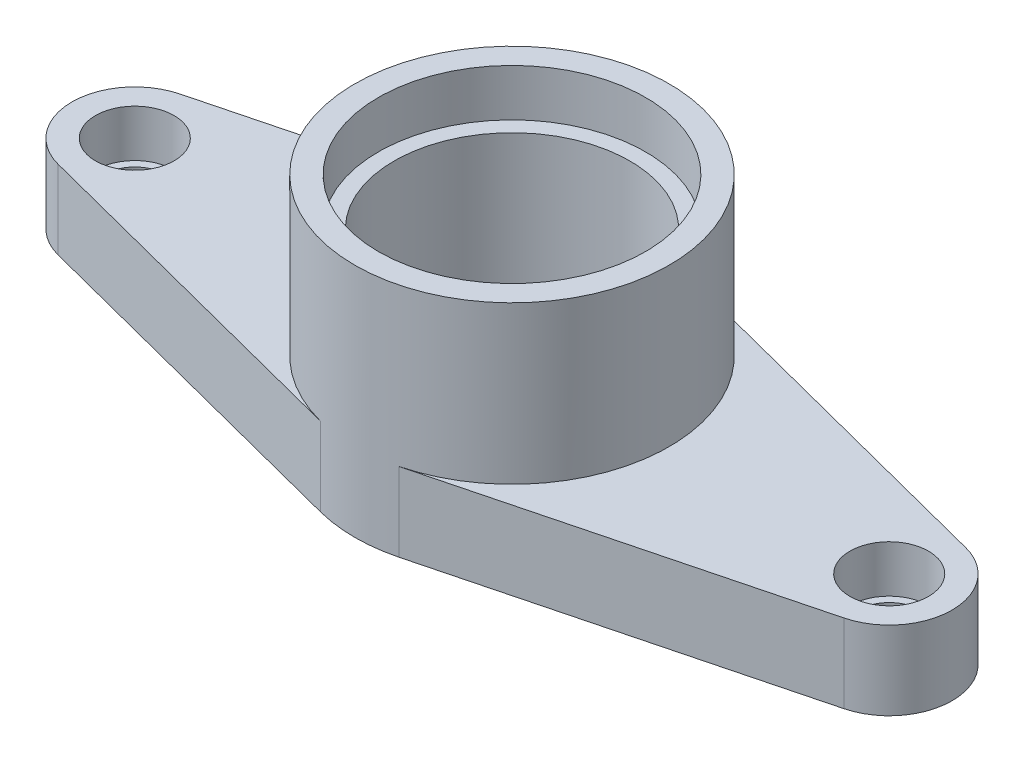
from build123d import *

# Parameters (mm, degrees)
SALIENTE_EXTRUIR1_DEPTH = 25
CROQUIS2_R              = 50
SALIENTE_EXTRUIR2_DEPTH = 50
CROQUIS3_R              = 42.5
CORTAR_EXTRUIR1_DEPTH   = 15
CROQUIS4_R              = 37.5
CORTAR_EXTRUIR2_DEPTH   = 161.312195419
CROQUIS5_R              = 12.5
CORTAR_EXTRUIR4_DEPTH   = 15
CROQUIS6_R              = 10
CORTAR_EXTRUIR6_DEPTH   = 163.249807396


with BuildPart() as part:
    # Croquis1 → Saliente-Extruir1 (new body)
    with BuildSketch(Plane(origin=(0, 0, 0), x_dir=(1, 0, 0), z_dir=(0, 1, 0))):
        with BuildLine():
            Line((-125, 19.364916731), (-12.5, 48.412291828))
            ThreePointArc((-12.5, 48.412291828), (0, 50), (12.5, 48.412291828))
            Line((12.5, 48.412291828), (125, 19.364916731))
            ThreePointArc((125, 19.364916731), (140, 0), (125, -19.364916731))
            Line((125, -19.364916731), (12.5, -48.412291828))
            ThreePointArc((12.5, -48.412291828), (0, -50), (-12.5, -48.412291828))
            Line((-12.5, -48.412291828), (-125, -19.364916731))
            ThreePointArc((-125, -19.364916731), (-140, 0), (-125, 19.364916731))
        make_face()
    extrude(amount=SALIENTE_EXTRUIR1_DEPTH)

    # Croquis2 → Saliente-Extruir2 (add)
    with BuildSketch(Plane(origin=(0, 25, 0), x_dir=(1, 0, 0), z_dir=(0, 1, 0))):
        with Locations(Location((0, 0, 0), (0, 0, 75.522487814))):
            Circle(CROQUIS2_R)
    extrude(amount=SALIENTE_EXTRUIR2_DEPTH)

    # Croquis3 → Cortar-Extruir1 (cut)
    with BuildSketch(Plane(origin=(0, 75, 0), x_dir=(1, 0, 0), z_dir=(0, 1, 0))):
        with Locations(Location((0, 0, 0), (0, 0, 270))):
            Circle(CROQUIS3_R)
    extrude(amount=-CORTAR_EXTRUIR1_DEPTH, mode=Mode.SUBTRACT)

    # Croquis4 → Cortar-Extruir2 (cut, through all)
    with BuildSketch(Plane(origin=(0, 60, 0), x_dir=(1, 0, 0), z_dir=(0, 1, 0))):
        with Locations(Location((0, 0, 0), (0, 0, 270))):
            Circle(CROQUIS4_R)
    extrude(amount=-CORTAR_EXTRUIR2_DEPTH, mode=Mode.SUBTRACT)

    # Croquis5 → Cortar-Extruir4 (cut)
    with BuildSketch(Plane(origin=(0, 25, 0), x_dir=(1, 0, 0), z_dir=(0, 1, 0))):
        with Locations(Location((-120, 0, 0), (0, 0, 270))):
            Circle(CROQUIS5_R)
        with Locations(Location((120, 0, 0), (0, 0, 270))):
            Circle(CROQUIS5_R)
    extrude(amount=-CORTAR_EXTRUIR4_DEPTH, mode=Mode.SUBTRACT)

    # Croquis6 → Cortar-Extruir6 (cut, through all)
    with BuildSketch(Plane(origin=(0, 10, 0), x_dir=(1, 0, 0), z_dir=(0, 1, 0))):
        with Locations(Location((-120, 0, 0), (0, 0, 270))):
            Circle(CROQUIS6_R)
        with Locations(Location((120, 0, 0), (0, 0, 270))):
            Circle(CROQUIS6_R)
    extrude(amount=-CORTAR_EXTRUIR6_DEPTH, mode=Mode.SUBTRACT)


solid = part.part
